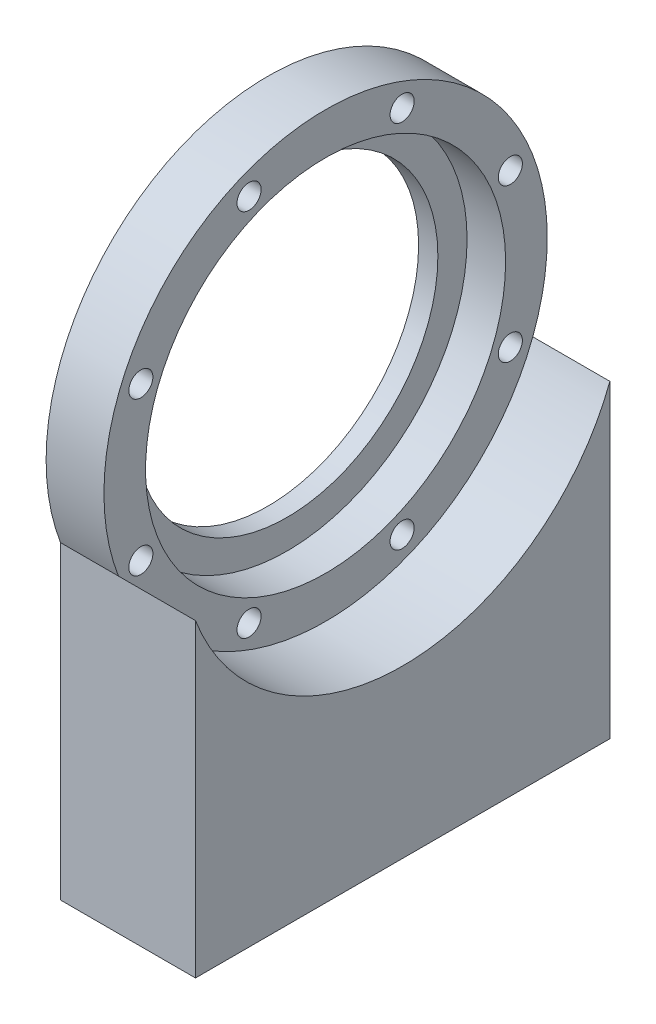
from build123d import *

# Parameters (mm, degrees)
SKETCH_1_R               = 18.68
SKETCH_1_R_2             = 15.652173913
EXTRUDE_2_DEPTH          = 2
SKETCH_1_4_R             = 23
SKETCH_1_4_R_2           = 1.25
SKETCH_1_4_R_3           = 18.68
EXTRUDE_3_DEPTH          = 6
EXTRUDE_4_DEPTH          = 14
SKETCH_4_R               = 1.8
CUT_EXTRUDE_1_DEPTH      = 5
MIRROR_2_COPY_1_SKETCH_R = 1.8
MIRROR_2_COPY_1_DEPTH    = 5
MIRROR_2_COPY_2_SKETCH_R = 1.8
MIRROR_2_COPY_2_DEPTH    = 5


with BuildPart() as part:
    # 草图1 → 凸台-拉伸2 (new body)
    with BuildSketch(Plane(origin=(0, 0, 0), x_dir=(0, 0, -1), z_dir=(1, 0, 0))):
        Circle(SKETCH_1_R)
        Circle(SKETCH_1_R_2, mode=Mode.SUBTRACT)
    extrude(amount=EXTRUDE_2_DEPTH)



with BuildPart() as body_2:
    # 草图1<4> → 凸台-拉伸3 (new body)
    with BuildSketch(Plane(origin=(0, 0, 0), x_dir=(0, 0, -1), z_dir=(1, 0, 0))):
        Circle(SKETCH_1_4_R)
        with Locations((-7.940681222, -19.1705003)):
            Circle(SKETCH_1_4_R_2, mode=Mode.SUBTRACT)
        with Locations((-19.1705003, -7.940681222)):
            Circle(SKETCH_1_4_R_2, mode=Mode.SUBTRACT)
        with Locations((7.940681222, -19.1705003)):
            Circle(SKETCH_1_4_R_2, mode=Mode.SUBTRACT)
        with Locations((19.1705003, -7.940681222)):
            Circle(SKETCH_1_4_R_2, mode=Mode.SUBTRACT)
        with Locations((-19.1705003, 7.940681222)):
            Circle(SKETCH_1_4_R_2, mode=Mode.SUBTRACT)
        with Locations((-7.940681222, 19.1705003)):
            Circle(SKETCH_1_4_R_2, mode=Mode.SUBTRACT)
        Circle(SKETCH_1_4_R_3, mode=Mode.SUBTRACT)
        with Locations((19.1705003, 7.940681222)):
            Circle(SKETCH_1_4_R_2, mode=Mode.SUBTRACT)
        with Locations((7.940681222, 19.1705003)):
            Circle(SKETCH_1_4_R_2, mode=Mode.SUBTRACT)
    extrude(amount=EXTRUDE_3_DEPTH)


with BuildPart() as part_1:
    add(part.part)

    add(body_2.part)  # 凸台-拉伸4 merges body 2
    # 草图2 → 凸台-拉伸4 (add)
    with BuildSketch(Plane.ZY):
        with BuildLine():
            Line((-21.5, -40.29), (21.5, -40.29))
            Line((21.5, -40.29), (21.5, -8.170067319))
            ThreePointArc((21.5, -8.170067319), (0, -23), (-21.5, -8.170067319))
            Line((-21.5, -8.170067319), (-21.5, -40.29))
        make_face()
    extrude(amount=-EXTRUDE_4_DEPTH)

    # 草图4 → 切除-拉伸1 (cut)
    with BuildSketch(Plane(origin=(0, -40.29, 0), x_dir=(-1, 0, 0), z_dir=(0, -1, 0))):
        with Locations((-10.536326609, -17.5)):
            Circle(SKETCH_4_R)
    cut_extrude_1 = extrude(amount=-CUT_EXTRUDE_1_DEPTH, mode=Mode.SUBTRACT)

    # 镜向1: 切除-拉伸1 across plane
    add(cut_extrude_1.mirror(Plane.XY), mode=Mode.SUBTRACT)

    # 镜向2 copy 1 sketch → 镜向2 copy 1 (cut)
    with BuildSketch(Plane(origin=(14, -40.29, 0), x_dir=(1, 0, 0), z_dir=(0, -1, 0))):
        with Locations((-10.536326609, -17.5)):
            Circle(MIRROR_2_COPY_1_SKETCH_R)
    extrude(amount=-MIRROR_2_COPY_1_DEPTH, mode=Mode.SUBTRACT)

    # 镜向2 copy 2 sketch → 镜向2 copy 2 (cut)
    with BuildSketch(Plane(origin=(14, -40.29, 0), x_dir=(1, 0, 0), z_dir=(0, -1, 0))):
        with Locations((-10.536326609, 17.5)):
            Circle(MIRROR_2_COPY_2_SKETCH_R)
    extrude(amount=-MIRROR_2_COPY_2_DEPTH, mode=Mode.SUBTRACT)


solid = part_1.part
